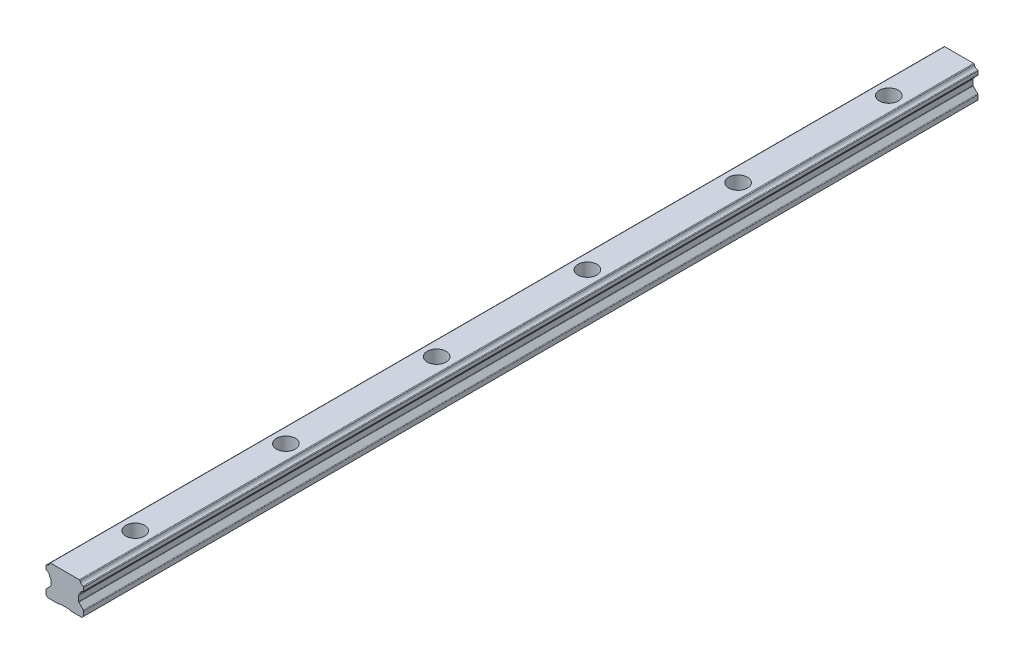
from build123d import *

# Parameters (mm, degrees)
BOSS_EXTRUDE101_DEPTH        = 356
SKETCH2_R                    = 1.5
CUT_EXTRUDE101_DEPTH         = 357.298330055
CHAMFER101_SIZE              = 0.7
FILLET101_R                  = 0.5
FILLET102_R                  = 0.3
FILLET103_R                  = 0.3
FILLET104_R                  = 0.3
CHAMFER101_OF_MIRROR101_SIZE = 0.7
FILLET101_OF_MIRROR101_R     = 0.5
FILLET102_OF_MIRROR101_R     = 0.3
FILLET103_OF_MIRROR101_R     = 0.3
FILLET104_OF_MIRROR101_R     = 0.3
CBORE101_D                   = 4.5
CBORE101_CBORE_D             = 7.5
CBORE101_CBORE_DEPTH         = 5.3
LPATTERN101_COUNT            = 6
LPATTERN101_PITCH            = 60


with BuildPart() as part:
    # Sketch1 → Boss-Extrude101 (new body)
    with BuildSketch(Plane.XY.offset(28)):
        Polygon((-2.05, 0.3), (0, 0.3), (0, 12.5), (-7.5, 12.5), (-7.5, 7.1), (-5.5, 7.1), (-5.5, 4.7), (-7.5, 2.7), (-7.5, 0), (-2.35, 0), align=None)
    boss_extrude101 = extrude(amount=-BOSS_EXTRUDE101_DEPTH)

    # Sketch2 → Cut-Extrude101 (cut, through all)
    with BuildSketch(Plane.XY.offset(28)):
        with Locations((-7.53, 12.53)):
            Circle(SKETCH2_R)
        with BuildLine():
            Line((-5.5, 7.1), (-6.030519656, 7.630519656))
            ThreePointArc((-6.030519656, 7.630519656), (-8.576608686, 8.744527923), (-7.53, 6.17))
            Line((-7.53, 6.17), (-7.5, 2.7))
            Line((-7.5, 2.7), (-5.5, 4.7))
            Line((-5.5, 4.7), (-5.5, 7.1))
        make_face()
    cut_extrude101 = extrude(amount=-CUT_EXTRUDE101_DEPTH, mode=Mode.SUBTRACT)

    # Chamfer101
    chamfer101_edges = [part.edges().sort_by_distance(p)[0] for p in [
        (-7.5, 0, -150),
    ]]
    chamfer(chamfer101_edges, length=CHAMFER101_SIZE)

    # Fillet101
    fillet101_edges = [part.edges().sort_by_distance(p)[0] for p in [
        (-7.5, 2.7, -150),
    ]]
    fillet(fillet101_edges, radius=FILLET101_R)

    # Fillet102
    fillet102_edges = [part.edges().sort_by_distance(p)[0] for p in [
        (-5.5, 7.1, -150),
    ]]
    fillet(fillet102_edges, radius=FILLET102_R)

    # Fillet103
    fillet103_edges = [part.edges().sort_by_distance(p)[0] for p in [
        (-7.5, 11.03030003, -150),
        (-6.03030003, 12.5, -150),
        (-7.5, 9.16969997, -150),
    ]]
    fillet(fillet103_edges, radius=FILLET103_R)

    # Fillet104
    fillet104_edges = [part.edges().sort_by_distance(p)[0] for p in [
        (-5.5, 4.7, -150),
    ]]
    fillet(fillet104_edges, radius=FILLET104_R)

    # Mirror101: Boss-Extrude101, Cut-Extrude101 across plane
    add(boss_extrude101.mirror(Plane(origin=(0, 0, 0), x_dir=(0, 0, 1), z_dir=(1, 0, 0))))
    add(cut_extrude101.mirror(Plane(origin=(0, 0, 0), x_dir=(0, 0, 1), z_dir=(1, 0, 0))), mode=Mode.SUBTRACT)

    # Chamfer101 of Mirror101
    chamfer101_of_mirror101_edges = [part.edges().sort_by_distance(p)[0] for p in [
        (7.5, 0, -150),
    ]]
    chamfer(chamfer101_of_mirror101_edges, length=CHAMFER101_OF_MIRROR101_SIZE)

    # Fillet101 of Mirror101
    fillet101_of_mirror101_edges = [part.edges().sort_by_distance(p)[0] for p in [
        (7.5, 2.7, -150),
    ]]
    fillet(fillet101_of_mirror101_edges, radius=FILLET101_OF_MIRROR101_R)

    # Fillet102 of Mirror101
    fillet102_of_mirror101_edges = [part.edges().sort_by_distance(p)[0] for p in [
        (5.5, 7.1, -150),
    ]]
    fillet(fillet102_of_mirror101_edges, radius=FILLET102_OF_MIRROR101_R)

    # Fillet103 of Mirror101
    fillet103_of_mirror101_edges = [part.edges().sort_by_distance(p)[0] for p in [
        (7.5, 11.03030003, -150),
        (6.03030003, 12.5, -150),
        (7.5, 9.16969997, -150),
    ]]
    fillet(fillet103_of_mirror101_edges, radius=FILLET103_OF_MIRROR101_R)

    # Fillet104 of Mirror101
    fillet104_of_mirror101_edges = [part.edges().sort_by_distance(p)[0] for p in [
        (5.5, 4.7, -150),
    ]]
    fillet(fillet104_of_mirror101_edges, radius=FILLET104_OF_MIRROR101_R)

    # CBORE101 (through all)
    with Locations(Plane(origin=(0, 12.5, 0), x_dir=(1, 0, 0), z_dir=(0, 1, 0))):
        with Locations((0, 0)):
            cbore101 = CounterBoreHole(CBORE101_D / 2, CBORE101_CBORE_D / 2, CBORE101_CBORE_DEPTH)

    # LPattern101: CBORE101 ×6
    with Locations(*[(0, 0, -i * LPATTERN101_PITCH) for i in range(1, LPATTERN101_COUNT)]):
        add(cbore101, mode=Mode.SUBTRACT)


solid = part.part
